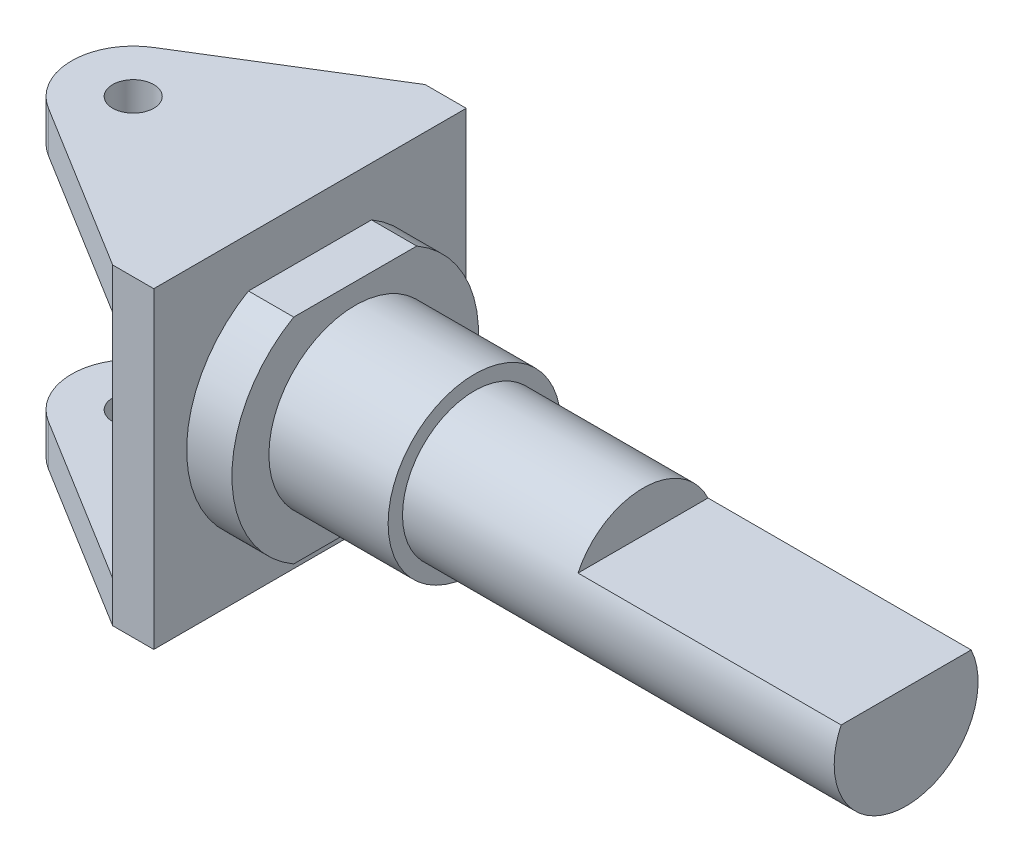
from build123d import *

# Parameters (mm, degrees)
SKETCH_2_W          = 53.579793819
SKETCH_2_H          = 11.740278351
CUT_EXTRUDE_1_DEPTH = 64
SKETCH_3_W          = 57.586414551
SKETCH_3_H          = 11.064638604
SKETCH_3_W_2        = 48.61735144
SKETCH_3_H_2        = 9.555824249
CUT_EXTRUDE_2_DEPTH = 64
SKETCH_4_W          = 76
SKETCH_4_H          = 76
EXTRUDE_1_DEPTH     = 10
SKETCH_5_R          = 5
EXTRUDE_2_DEPTH     = 10


with BuildPart() as part:
    # 스케치1 → 회전1 (revolve)
    with BuildSketch(Plane.XY, mode=Mode.PRIVATE) as revolve_1_sk:
        Polygon((-16.680473815, 0), (-16.680473815, 30), (-5.680473815, 30), (-5.680473815, 21), (23.319526185, 21), (23.319526185, 17.5), (128.319526185, 17.5), (128.319526185, 0), align=None)
    revolve(revolve_1_sk.sketch.rotate(Axis((-16.680473815, 0, 0), (1, 0, 0)), 90), axis=Axis((-16.680473815, 0, 0), (1, 0, 0)))

    # 스케치2 → 컷-돌출1 (cut)
    with BuildSketch(Plane(origin=(128.319526185, 0, 0), x_dir=(0, 0, -1), z_dir=(1, 0, 0))):
        with Locations((8.115762888, 13.370139176)):
            Rectangle(SKETCH_2_W, SKETCH_2_H)
    extrude(amount=-CUT_EXTRUDE_1_DEPTH, mode=Mode.SUBTRACT)

    # 스케치3 → 컷-돌출2 (cut)
    with BuildSketch(Plane(origin=(-5.680473815, 0, 0), x_dir=(0, 0, -1), z_dir=(1, 0, 0))):
        with Locations((-0.377203588, 31.532319302)):
            Rectangle(SKETCH_3_W, SKETCH_3_H)
        with Locations((-1.173522276, -30.777912125)):
            Rectangle(SKETCH_3_W_2, SKETCH_3_H_2)
    extrude(amount=-CUT_EXTRUDE_2_DEPTH, mode=Mode.SUBTRACT)

    # 스케치4 → 보스-돌출1 (add)
    with BuildSketch(Plane.ZY.offset(16.680473815)):
        Rectangle(SKETCH_4_W, SKETCH_4_H)
    extrude(amount=EXTRUDE_1_DEPTH)

    # 스케치5 → 보스-돌출2 (add)
    with BuildSketch(Plane(origin=(0, 38, 0), x_dir=(1, 0, 0), z_dir=(0, 1, 0))):
        with BuildLine():
            ThreePointArc((-67.559960472, -12.763764728), (-74.680473815, 0), (-67.559960472, 12.763764728))
            Line((-67.559960472, 12.763764728), (-26.680473815, 38))
            Line((-26.680473815, 38), (-26.680473815, -38))
            Line((-26.680473815, -38), (-67.559960472, -12.763764728))
        make_face()
        with Locations(Location((-59.680473815, 0, 0), (0, 0, 270))):
            Circle(SKETCH_5_R, mode=Mode.SUBTRACT)
    extrude_2 = extrude(amount=-EXTRUDE_2_DEPTH)

    # 대칭 복사1: 보스-돌출2 across plane
    add(extrude_2.mirror(Plane.ZX))


solid = part.part
